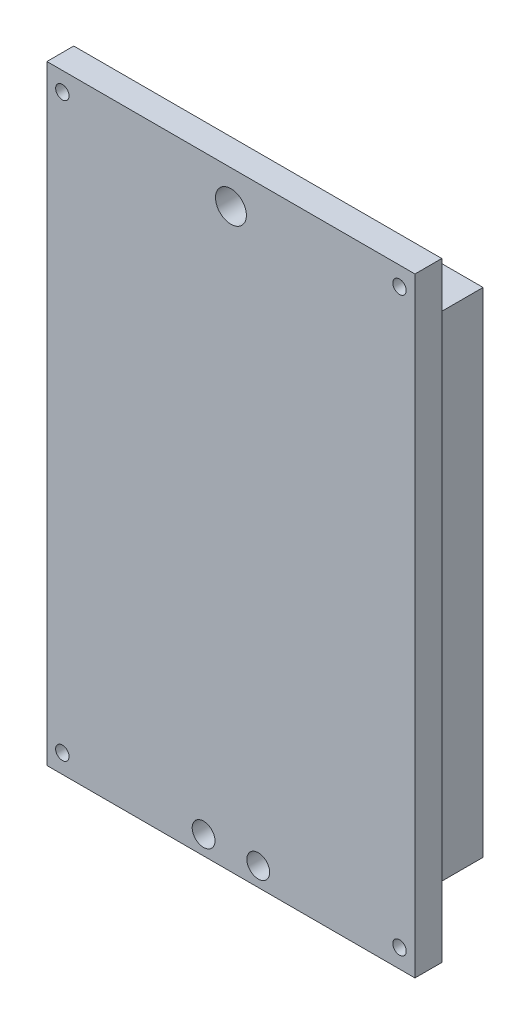
from build123d import *

# Parameters (mm, degrees)
SKETCH1_W                        = 68.600000001
SKETCH1_H                        = 113.65
BRACKETBASE_DEPTH                = 5
ARDUINOMOUNTINGHOLES_DEPTH       = 22
ARDUINOMOUNTINGHOLES_DEPTH_BACK  = 120.777809299
ARDUINOMOUNTINGHOLESSKETCH_R     = 1.25
F_9VBATTERYMOUNTINGHOLESSKETCH_R = 1.25
F_9VBATTERYMOUNTINGHOLES_DEPTH   = 20
LEGBRACKETMOUNTINGHOLESSKETCH_R  = 2
LEGBRACKETMOUNTINGHOLES_DEPTH    = 13
BACKSIDEMOUNTINGHOLESSKETCH_R    = 1.25
BACKSIDEMOUNTINGHOLES_DEPTH      = 24
COVER_START                      = -5
SKETCH2_R                        = 1.25
SKETCH2_R_2                      = 2
COVER_DEPTH                      = 5
SKETCH3_W                        = 64
SKETCH3_H                        = 92
SKETCH3_W_2                      = 58
SKETCH3_H_2                      = 86
BREADBOARDCAVITY_DEPTH           = 10
SKETCH4_W                        = 64
SKETCH4_H                        = 10
CUT_EXTRUDE1_DEPTH               = 125.514820906
SKETCH5_R                        = 2.875
TOGGLESWITCHHOLE_DEPTH           = 10
SKETCH6_R                        = 2.125
CUT_EXTRUDE2_DEPTH               = 10


with BuildPart() as part:
    # Sketch1 → bracketBase (new body)
    with BuildSketch(Plane.XY):
        with Locations((34.3, 41.235000001)):
            Rectangle(SKETCH1_W, SKETCH1_H)
    extrude(amount=BRACKETBASE_DEPTH)

    # arduinoMountingHolesSketch → arduinoMountingHoles (cut, two sides: drawn at the far end of the back side and taken through both)
    with BuildSketch(Plane.XY.offset(-ARDUINOMOUNTINGHOLES_DEPTH_BACK)):
        with Locations((2.54, 2.280000001)):
            Circle(ARDUINOMOUNTINGHOLESSKETCH_R)
        with Locations((2.54, 30.450000001)):
            Circle(ARDUINOMOUNTINGHOLESSKETCH_R)
        with Locations((54.600000001, 35.270000001)):
            Circle(ARDUINOMOUNTINGHOLESSKETCH_R)
        with Locations((53.350000001, -13.049999999)):
            Circle(ARDUINOMOUNTINGHOLESSKETCH_R)
    extrude(amount=ARDUINOMOUNTINGHOLES_DEPTH + ARDUINOMOUNTINGHOLES_DEPTH_BACK, mode=Mode.SUBTRACT)

    # 9VbatteryMountingHolesSketch → 9VbatteryMountingHoles (cut)
    with BuildSketch(Plane.XY):
        with Locations((8.625000001, 86.060000001)):
            Circle(F_9VBATTERYMOUNTINGHOLESSKETCH_R)
        with Locations(Location((59.975000001, 86.060000001, 0), (0, 0, 180))):
            Circle(F_9VBATTERYMOUNTINGHOLESSKETCH_R)
        with Locations(Location((8.625000001, 42.810000001, 0), (0, 0, 180))):
            Circle(F_9VBATTERYMOUNTINGHOLESSKETCH_R)
        with Locations((59.975000001, 42.810000001)):
            Circle(F_9VBATTERYMOUNTINGHOLESSKETCH_R)
    extrude(amount=F_9VBATTERYMOUNTINGHOLES_DEPTH, mode=Mode.SUBTRACT)

    # legBracketMountingHolesSketch → legBracketMountingHoles (cut)
    with BuildSketch(Plane.XY):
        with Locations((29.202551646, 94.560000001)):
            Circle(LEGBRACKETMOUNTINGHOLESSKETCH_R)
        with Locations(Location((39.397448356, 94.560000001, 0), (0, 0, 180))):
            Circle(LEGBRACKETMOUNTINGHOLESSKETCH_R)
    extrude(amount=LEGBRACKETMOUNTINGHOLES_DEPTH, mode=Mode.SUBTRACT)

    # backsideMountingHolesSketch → backsideMountingHoles (cut)
    with BuildSketch(Plane.XY):
        with Locations((2.875000001, 94.560000001)):
            Circle(BACKSIDEMOUNTINGHOLESSKETCH_R)
        with Locations(Location((65.725000001, 94.560000001, 0), (0, 0, 180))):
            Circle(BACKSIDEMOUNTINGHOLESSKETCH_R)
        with Locations((65.725000001, -12.089999999)):
            Circle(BACKSIDEMOUNTINGHOLESSKETCH_R)
        with Locations(Location((2.875000001, -12.089999999, 0), (0, 0, 180))):
            Circle(BACKSIDEMOUNTINGHOLESSKETCH_R)
    extrude(amount=BACKSIDEMOUNTINGHOLES_DEPTH, mode=Mode.SUBTRACT)

    # Sketch2 → cover (add)
    with BuildSketch(Plane.XY.offset(5).offset(COVER_START)):
        with Locations((53.350000001, -13.049999999)):
            Circle(SKETCH2_R)
        with Locations((2.54, 2.280000001)):
            Circle(SKETCH2_R)
        with Locations((2.54, 30.450000001)):
            Circle(SKETCH2_R)
        with Locations((54.600000001, 35.270000001)):
            Circle(SKETCH2_R)
        with Locations((59.975000001, 42.810000001)):
            Circle(SKETCH2_R)
        with Locations((8.625000001, 42.810000001)):
            Circle(SKETCH2_R)
        with Locations((59.975000001, 86.060000001)):
            Circle(SKETCH2_R)
        with Locations((39.397448356, 94.560000001)):
            Circle(SKETCH2_R_2)
        with Locations((29.202551646, 94.560000001)):
            Circle(SKETCH2_R_2)
        with Locations((8.625000001, 86.060000001)):
            Circle(SKETCH2_R)
    extrude(amount=COVER_DEPTH)

    # Sketch3 → breadBoardCavity (add)
    with BuildSketch(Plane.XY.offset(5)):
        with Locations((34.300000001, 41.235000001)):
            Rectangle(SKETCH3_W, SKETCH3_H)
        with Locations((34.300000001, 41.235000001)):
            Rectangle(SKETCH3_W_2, SKETCH3_H_2, mode=Mode.SUBTRACT)
    breadboardcavity = extrude(amount=BREADBOARDCAVITY_DEPTH)

    # Mirror1: breadBoardCavity across plane
    add(breadboardcavity.mirror(Plane.XY.offset(2.5)))

    # Sketch4 → Cut-Extrude1 (cut, through all)
    with BuildSketch(Plane(origin=(0, 87.235000001, 0), x_dir=(1, 0, 0), z_dir=(0, 1, 0))):
        with Locations((34.300000001, -10)):
            Rectangle(SKETCH4_W, SKETCH4_H)
    extrude(amount=-CUT_EXTRUDE1_DEPTH, mode=Mode.SUBTRACT)

    # Sketch5 → toggleSwitchHole (cut)
    with BuildSketch(Plane(origin=(0, 0, 0), x_dir=(-1, 0, 0), z_dir=(0, 0, -1))):
        with Locations((-34.300000001, 91.810031891)):
            Circle(SKETCH5_R)
    extrude(amount=-TOGGLESWITCHHOLE_DEPTH, mode=Mode.SUBTRACT)

    # Sketch6 → Cut-Extrude2 (cut)
    with BuildSketch(Plane(origin=(0, 0, 0), x_dir=(-1, 0, 0), z_dir=(0, 0, -1))):
        with Locations((-39.397448351, -12.089999999)):
            Circle(SKETCH6_R)
        with Locations(Location((-29.202551651, -12.089999999, 0), (0, 0, 180))):
            Circle(SKETCH6_R)
    extrude(amount=-CUT_EXTRUDE2_DEPTH, mode=Mode.SUBTRACT)


solid = part.part
